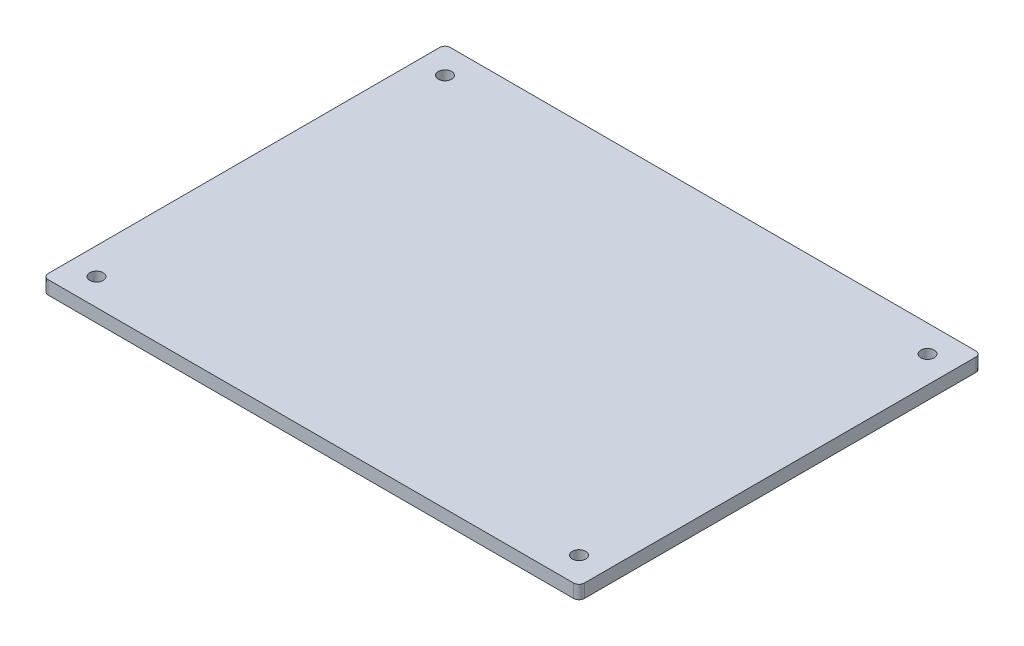
from build123d import *

# Parameters (mm, degrees)
SKETCH1_W           = 200
SKETCH1_H           = 150
BOSS_EXTRUDE1_DEPTH = 5
FILLET1_R           = 2
CUT_EXTRUDE1_REACH  = 252.05
SKETCH2_R           = 2.5


with BuildPart() as part:
    # Sketch1 → Boss-Extrude1 (new body)
    with BuildSketch(Plane(origin=(0, 0, 0), x_dir=(1, 0, 0), z_dir=(0, 1, 0))):
        with Locations((100, 75)):
            Rectangle(SKETCH1_W, SKETCH1_H)
    extrude(amount=BOSS_EXTRUDE1_DEPTH)

    # Fillet1
    fillet1_edges = [part.edges().sort_by_distance(p)[0] for p in [
        (0, 2.5, -150),
        (200, 2.5, -150),
        (200, 2.5, 0),
        (0, 2.5, 0),
    ]]
    fillet(fillet1_edges, radius=FILLET1_R)

    # Sketch2 → Cut-Extrude1 (cut, up to next)
    with BuildSketch(Plane(origin=(0, 5, 0), x_dir=(1, 0, 0), z_dir=(0, 1, 0)), mode=Mode.PRIVATE) as cut_extrude1_sk1:
        with Locations(Location((10, 140, 0), (0, 0, 270))):
            Circle(SKETCH2_R)
    cut_extrude1_tool1 = extrude(cut_extrude1_sk1.sketch, amount=-CUT_EXTRUDE1_REACH, mode=Mode.PRIVATE) & part.part
    # Sketch2 → Cut-Extrude1 (cut, up to next)
    with BuildSketch(Plane(origin=(0, 5, 0), x_dir=(1, 0, 0), z_dir=(0, 1, 0)), mode=Mode.PRIVATE) as cut_extrude1_sk2:
        with Locations(Location((190, 140, 0), (0, 0, 270))):
            Circle(SKETCH2_R)
    cut_extrude1_tool2 = extrude(cut_extrude1_sk2.sketch, amount=-CUT_EXTRUDE1_REACH, mode=Mode.PRIVATE) & part.part
    # Sketch2 → Cut-Extrude1 (cut, up to next)
    with BuildSketch(Plane(origin=(0, 5, 0), x_dir=(1, 0, 0), z_dir=(0, 1, 0)), mode=Mode.PRIVATE) as cut_extrude1_sk3:
        with Locations(Location((190, 10, 0), (0, 0, 270))):
            Circle(SKETCH2_R)
    cut_extrude1_tool3 = extrude(cut_extrude1_sk3.sketch, amount=-CUT_EXTRUDE1_REACH, mode=Mode.PRIVATE) & part.part
    # Sketch2 → Cut-Extrude1 (cut, up to next)
    with BuildSketch(Plane(origin=(0, 5, 0), x_dir=(1, 0, 0), z_dir=(0, 1, 0)), mode=Mode.PRIVATE) as cut_extrude1_sk4:
        with Locations(Location((10, 10, 0), (0, 0, 270))):
            Circle(SKETCH2_R)
    cut_extrude1_tool4 = extrude(cut_extrude1_sk4.sketch, amount=-CUT_EXTRUDE1_REACH, mode=Mode.PRIVATE) & part.part
    add(cut_extrude1_tool1.solids().sort_by_distance((10, 5, -140))[0], mode=Mode.SUBTRACT)
    add(cut_extrude1_tool2.solids().sort_by_distance((190, 5, -140))[0], mode=Mode.SUBTRACT)
    add(cut_extrude1_tool3.solids().sort_by_distance((190, 5, -10))[0], mode=Mode.SUBTRACT)
    add(cut_extrude1_tool4.solids().sort_by_distance((10, 5, -10))[0], mode=Mode.SUBTRACT)


solid = part.part
